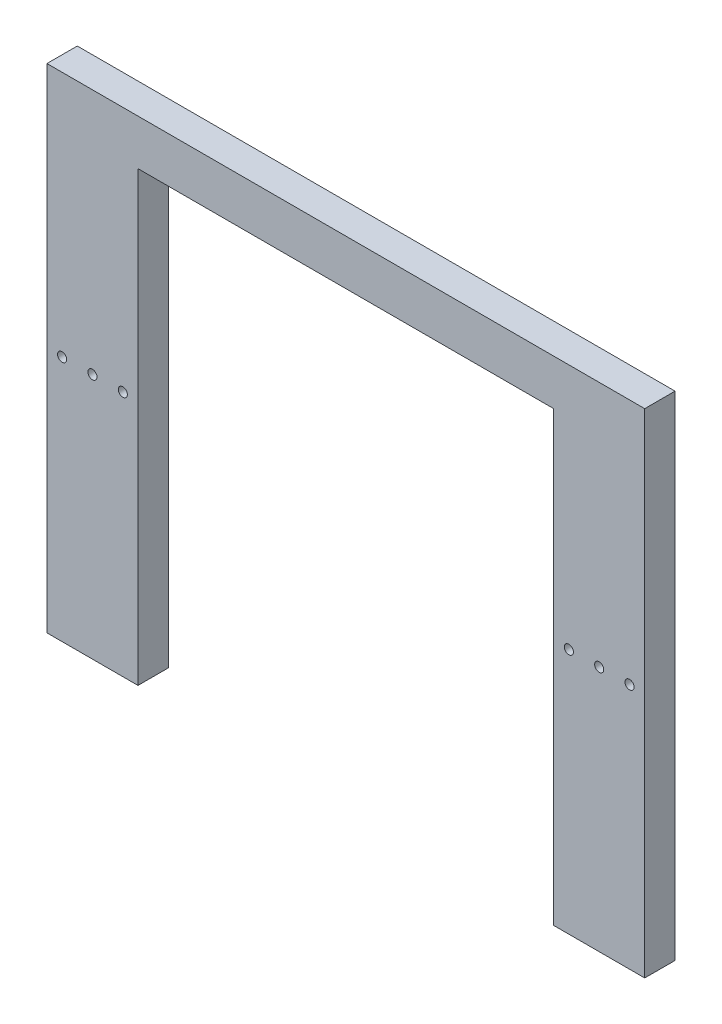
from build123d import *

# Parameters (mm, degrees)
SKETCH_1_W          = 60
SKETCH_1_H          = 325
EXTRUDE_1_DEPTH     = 20
EXTRUDE_1_2_DEPTH   = 20
SKETCH_3_R          = 3
CUT_EXTRUDE_1_DEPTH = 10
SKETCH_5_W          = 274
SKETCH_5_H          = 30
EXTRUDE_2_DEPTH     = 20


with BuildPart() as part:
    # 草图1 → 凸台-拉伸1 (new body)
    with BuildSketch(Plane.XY):
        with Locations((30, -162.5)):
            Rectangle(SKETCH_1_W, SKETCH_1_H)
    extrude(amount=EXTRUDE_1_DEPTH)


with BuildPart() as body_2:
    # 草图1 → Extrude 1 2 (new body)
    with BuildSketch(Plane.XY):
        with Locations((-304, -162.5)):
            Rectangle(SKETCH_1_W, SKETCH_1_H)
    extrude(amount=EXTRUDE_1_2_DEPTH)


with BuildPart() as cut_extrude_1_tool:
    # 草图3 → 切除-拉伸1 (new body)
    with BuildSketch(Plane.XY.offset(20)):
        with Locations((50, -162.5)):
            Circle(SKETCH_3_R)
        with Locations((10, -162.5)):
            Circle(SKETCH_3_R)
        with Locations((30, -162.5)):
            Circle(SKETCH_3_R)
        with Locations((-324, -162.5)):
            Circle(SKETCH_3_R)
        with Locations((-304, -162.5)):
            Circle(SKETCH_3_R)
        with Locations((-284, -162.5)):
            Circle(SKETCH_3_R)
    extrude(amount=-CUT_EXTRUDE_1_DEPTH)


with BuildPart() as part_1:
    add(part.part)

    # 切除-拉伸1: cut by cut_extrude_1_tool
    add(cut_extrude_1_tool.part, mode=Mode.SUBTRACT)



with BuildPart() as body_2_1:
    add(body_2.part)

    # 切除-拉伸1: cut by cut_extrude_1_tool
    add(cut_extrude_1_tool.part, mode=Mode.SUBTRACT)


with BuildPart() as part_2:
    add(part_1.part)

    add(body_2_1.part)  # 凸台-拉伸2 merges body 2
    # 草图5 → 凸台-拉伸2 (add)
    with BuildSketch(Plane.XY.offset(20)):
        with Locations((-137, -15)):
            Rectangle(SKETCH_5_W, SKETCH_5_H)
    extrude(amount=-EXTRUDE_2_DEPTH)


solid = part_2.part
